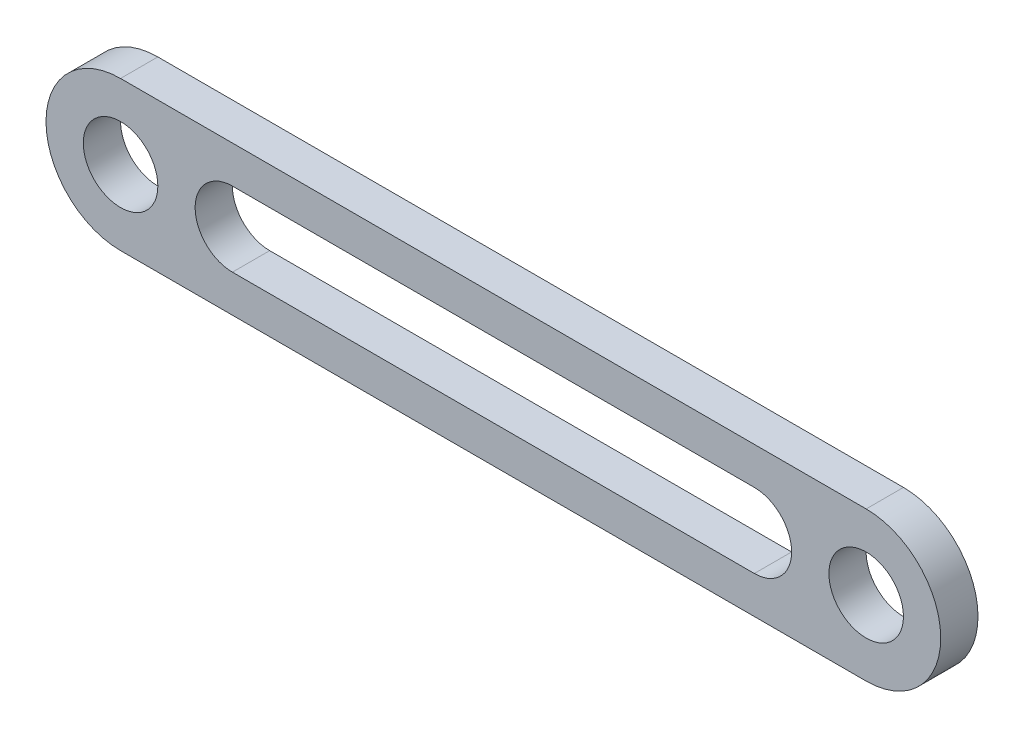
from build123d import *

# Parameters (mm, degrees)
ESBO_O1_R                = 5
RESSALTO_EXTRUS_O1_DEPTH = 5


with BuildPart() as part:
    # Esboço1 → Ressalto-extrusão1 (new body)
    with BuildSketch(Plane.XY):
        with BuildLine():
            Line((-19.446898693, 13.244129565), (-119.446898693, 13.244129565))
            ThreePointArc((-119.446898693, 13.244129565), (-129.446898693, 3.244129565), (-119.446898693, -6.755870435))
            Line((-119.446898693, -6.755870435), (-19.295466425, -6.755870435))
            Line((-19.295466425, -6.755870435), (-19.295466425, -6.754723783))
            ThreePointArc((-19.295466425, -6.754723783), (-9.446898693, 3.244129565), (-19.295466425, 13.242982913))
            ThreePointArc((-19.295466425, 13.242982913), (-19.371180388, 13.243842898), (-19.446898693, 13.244129565))
        make_face()
        with Locations((-119.446898693, 3.244129565)):
            Circle(ESBO_O1_R, mode=Mode.SUBTRACT)
        with BuildLine():
            ThreePointArc((-104.446898693, -1.755870435), (-109.446898693, 3.244129565), (-104.446898693, 8.244129565))
            Line((-104.446898693, 8.244129565), (-34.446898693, 8.244129565))
            ThreePointArc((-34.446898693, 8.244129565), (-29.446898693, 3.244129565), (-34.446898693, -1.755870435))
            Line((-34.446898693, -1.755870435), (-104.446898693, -1.755870435))
        make_face(mode=Mode.SUBTRACT)
        with Locations((-19.446898693, 3.244129565)):
            Circle(ESBO_O1_R, mode=Mode.SUBTRACT)
    extrude(amount=RESSALTO_EXTRUS_O1_DEPTH)


solid = part.part
